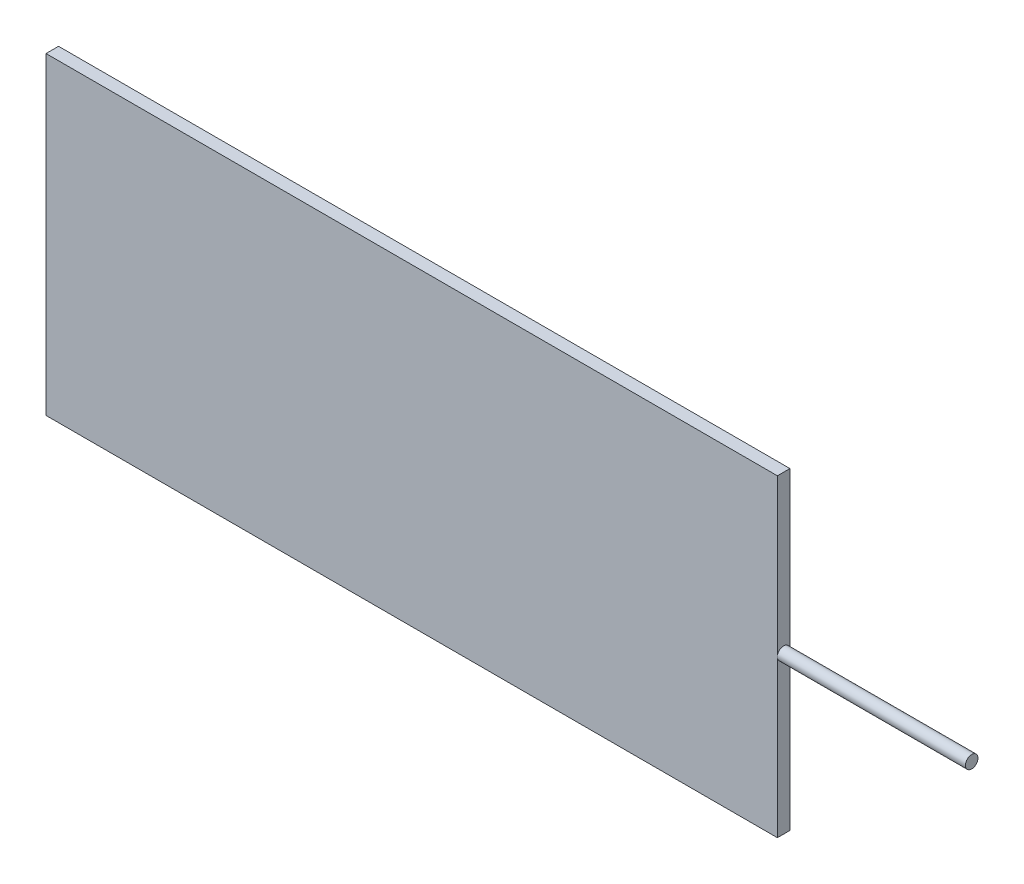
from build123d import *

# Parameters (mm, degrees)
SKETCH_1_W      = 350
SKETCH_1_H      = 150
EXTRUDE_1_DEPTH = 6
SKETCH_2_R      = 3
EXTRUDE_2_DEPTH = 90


with BuildPart() as part:
    # 草图1 → 凸台-拉伸1 (new body)
    with BuildSketch(Plane.XY):
        with Locations((175, 75)):
            Rectangle(SKETCH_1_W, SKETCH_1_H)
    extrude(amount=EXTRUDE_1_DEPTH)

    # 草图2 → 凸台-拉伸2 (add)
    with BuildSketch(Plane(origin=(350, 0, 0), x_dir=(0, 0, -1), z_dir=(1, 0, 0))):
        with Locations((-3, 75)):
            Circle(SKETCH_2_R)
    extrude(amount=EXTRUDE_2_DEPTH)


solid = part.part
